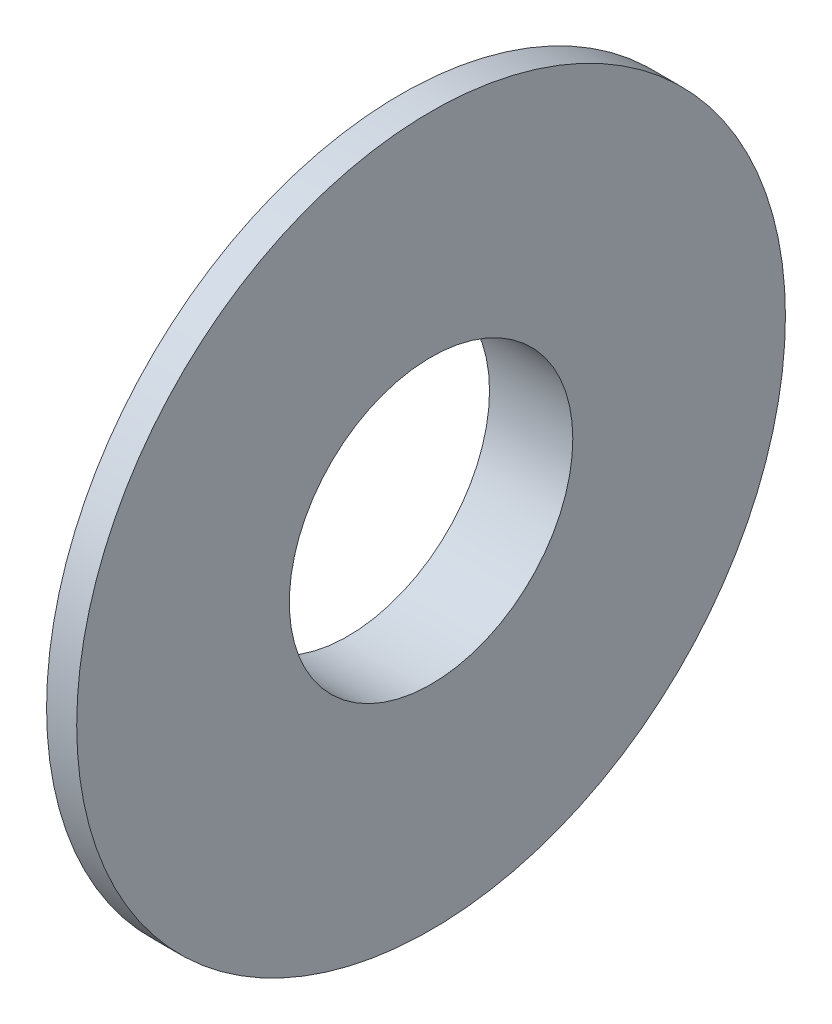
from build123d import *


with BuildPart() as part:
    # Sketch1 → Revolve1 (revolve)
    with BuildSketch(Plane.XY, mode=Mode.PRIVATE) as revolve1_sk:
        Polygon((-1.5, 4), (-1.5, 5.5), (0, 5.5), (0, 10), (0.85, 10), (0.85, 4), align=None)
    revolve(revolve1_sk.sketch.rotate(Axis((-14.267200935, 0, 0), (1, 0, 0)), 270), axis=Axis((-14.267200935, 0, 0), (1, 0, 0)))


solid = part.part
